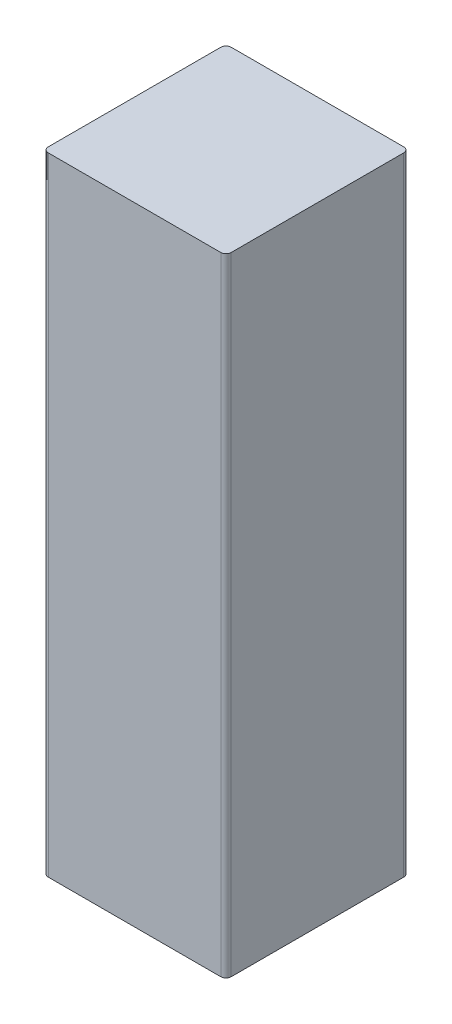
from build123d import *

# Parameters (mm, degrees)
SKETCH1_W           = 88.9
SKETCH1_H           = 88.9
BOSS_EXTRUDE1_DEPTH = 304.8
FILLET1_R           = 2.54


with BuildPart() as part:
    # Sketch1 → Boss-Extrude1 (new body)
    with BuildSketch(Plane(origin=(0, 0, 0), x_dir=(1, 0, 0), z_dir=(0, 1, 0))):
        Rectangle(SKETCH1_W, SKETCH1_H)
    extrude(amount=BOSS_EXTRUDE1_DEPTH)

    # Fillet1
    fillet1_edges = [part.edges().sort_by_distance(p)[0] for p in [
        (44.45, 152.4, 44.45),
        (-44.45, 152.4, 44.45),
        (-44.45, 152.4, -44.45),
        (44.45, 152.4, -44.45),
    ]]
    fillet(fillet1_edges, radius=FILLET1_R)


solid = part.part
